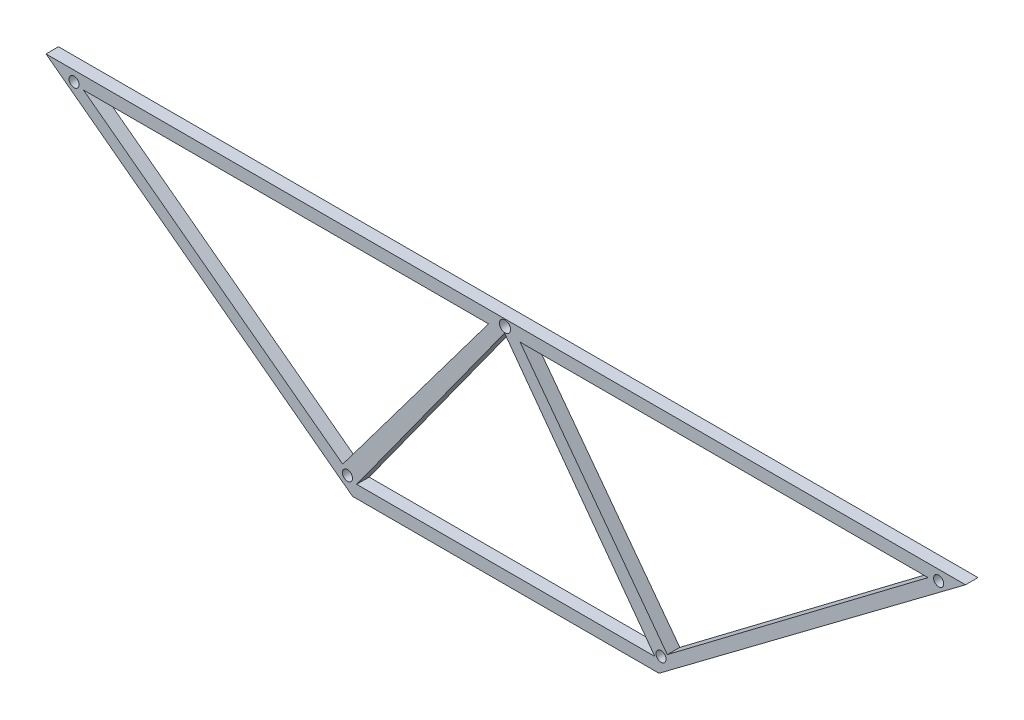
from build123d import *

# Parameters (mm, degrees)
BOSS_EXTRUDE1_DEPTH = 16.31
CUT_EXTRUDE4_DEPTH  = 130.31
SKETCH3_R           = 7.316006069
SKETCH3_R_2         = 6.6
CUT_EXTRUDE6_DEPTH  = 130.31


with BuildPart() as part:
    # Sketch1 → Boss-Extrude1 (new body)
    with BuildSketch(Plane.XY):
        Polygon((-800, 300), (400, 300), (0, 0), (-400, 0), align=None)
        Polygon((-394.563333333, 16.31), (-5.436666667, 16.31), (-201.528049499, 283.69), align=None, mode=Mode.SUBTRACT)
    extrude(amount=-BOSS_EXTRUDE1_DEPTH)

    # Sketch2 → Cut-Extrude4 (cut)
    with BuildSketch(Plane.XY):
        Polygon((-181.30202164, 283.69), (10.873333333, 26.546261845), (351.07, 283.69), align=None)
        Polygon((-751.07, 283.69), (-222.488676184, 283.69), (-412.777952758, 29.970964568), align=None)
    extrude(amount=-CUT_EXTRUDE4_DEPTH, mode=Mode.SUBTRACT)

    # Sketch3 → Cut-Extrude6 (cut)
    with BuildSketch(Plane.XY):
        with Locations((-200.996317691, 291.556411045)):
            Circle(SKETCH3_R)
        with Locations((-763.369850402, 286.770824774)):
            Circle(SKETCH3_R_2)
        with Locations((364.965045825, 286.770824774)):
            Circle(SKETCH3_R_2)
        with Locations((2.613340708, 20.373189048)):
            Circle(SKETCH3_R_2)
        with Locations((-406.577807344, 20.373189048)):
            Circle(SKETCH3_R_2)
    extrude(amount=-CUT_EXTRUDE6_DEPTH, mode=Mode.SUBTRACT)


solid = part.part
